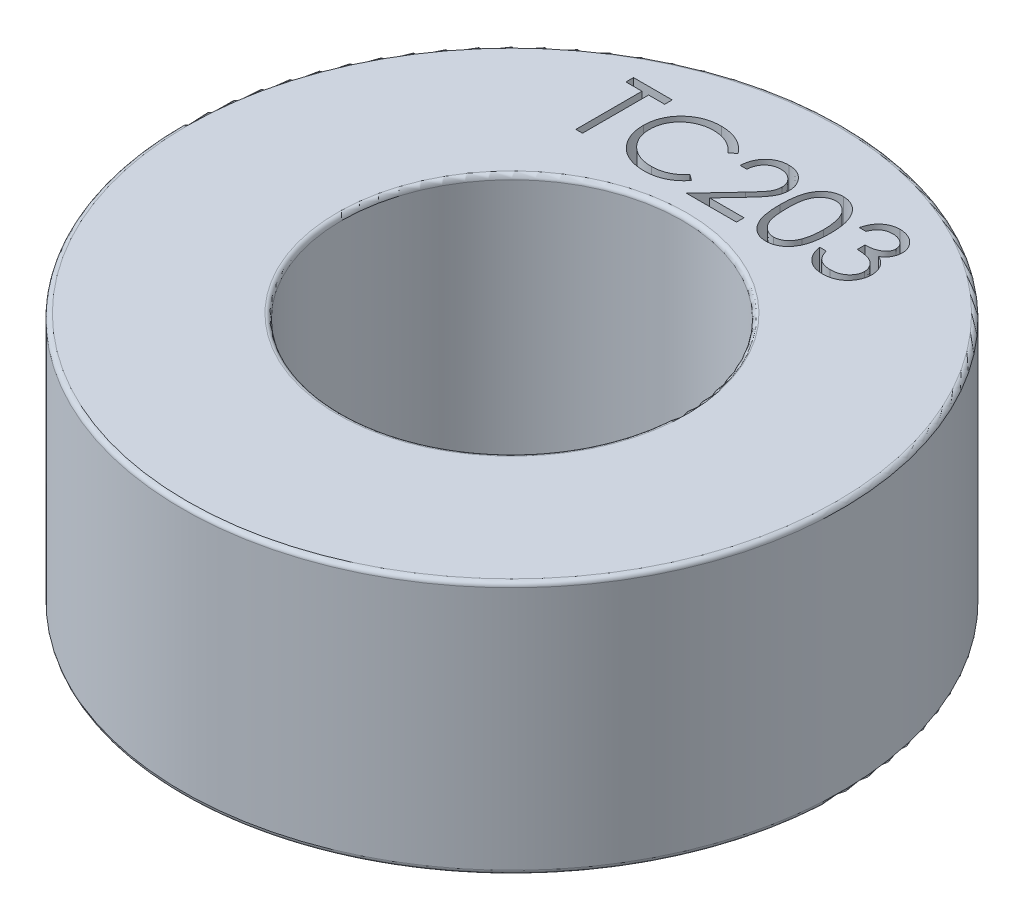
from build123d import *

# Parameters (mm, degrees)
CUT_EXTRUDE1_DEPTH = 1


with BuildPart() as part:
    # Toroidal Core TC229 → Revolve2 (revolve)
    with BuildSketch(Plane.XY, mode=Mode.PRIVATE) as revolve2_sk:
        with BuildLine():
            Line((5.646058459, 0), (10.503941541, 0))
            ThreePointArc((10.503941541, 0), (10.607220468, 0.042779532), (10.65, 0.146058459))
            Line((10.65, 0.146058459), (10.65, 8.053941541))
            ThreePointArc((10.65, 8.053941541), (10.607220468, 8.157220468), (10.503941541, 8.2))
            Line((10.503941541, 8.2), (5.646058459, 8.2))
            ThreePointArc((5.646058459, 8.2), (5.542779532, 8.157220468), (5.5, 8.053941541))
            Line((5.5, 8.053941541), (5.5, 0.146058459))
            ThreePointArc((5.5, 0.146058459), (5.542779532, 0.042779532), (5.646058459, 0))
        make_face()
    revolve(revolve2_sk.sketch.rotate(Axis((0, -8.107972275, 0), (0, 1, 0)), 90), axis=Axis((0, -8.107972275, 0), (0, 1, 0)))

    # Sketch1 → Cut-Extrude1 (cut)
    # profile 1 of 5: a face of its own
    with BuildSketch(Plane(origin=(0, 8.2, 0), x_dir=(1, 0, 0), z_dir=(0, 1, 0))):
        Polygon((-4.639181187, 8.322520552), (-4.639181187, 8.566751321), (-3.387498495, 8.566751321), (-3.387498495, 8.322520552), (-3.90648888, 8.322520552), (-3.90648888, 6.185501321), (-4.120190803, 6.185501321), (-4.120190803, 8.322520552), align=None)
    # profile 2 of 5: a face of its own
    with BuildSketch(Plane(origin=(0, 8.2, 0), x_dir=(1, 0, 0), z_dir=(0, 1, 0))):
        with BuildLine():
            Line((-0.823075418, 8.129807211), (-1.010064601, 7.986703244))
            add(Edge.make_bspline(
                [(-1.010064601, 7.986703244), (-1.023403607, 8.002600449), (-1.049901781, 8.034180529), (-1.092532417, 8.078525898), (-1.136960856, 8.120072085), (-1.183170115, 8.159017006), (-1.231991945, 8.19399877), (-1.282243666, 8.22684036), (-1.334765908, 8.256277874), (-1.407395213, 8.291971442), (-1.502405624, 8.329218379), (-1.622008899, 8.360448971), (-1.746861985, 8.380329806), (-1.832041066, 8.382483029), (-1.875366584, 8.383578244)],
                knots=[0, 0, 0, 0, 0.757959112, 1.505699292, 2.245454638, 2.979532153, 3.711538275, 4.438200793, 5.171680507, 5.909471876, 7.393775596, 8.890124382, 10.418191784, 12, 12, 12, 12], degree=3))
            add(Edge.make_bspline(
                [(-1.875366584, 8.383578244), (-1.899235757, 8.383303406), (-1.946752575, 8.382756279), (-2.017270555, 8.375538285), (-2.086471756, 8.365393337), (-2.154311164, 8.350340215), (-2.220702427, 8.331308844), (-2.286079579, 8.308567625), (-2.349496076, 8.280431564), (-2.411829199, 8.249333623), (-2.471550412, 8.214208522), (-2.528057507, 8.175895331), (-2.581144392, 8.134822785), (-2.630853062, 8.090836943), (-2.677234334, 8.044135895), (-2.71995213, 7.994221941), (-2.758858632, 7.941254658), (-2.794725037, 7.885932501), (-2.826846557, 7.82841661), (-2.853740993, 7.768494107), (-2.877556978, 7.707191137), (-2.896402355, 7.643815079), (-2.911318857, 7.578811876), (-2.921611071, 7.512007072), (-2.928746977, 7.44354023), (-2.929291383, 7.397133536), (-2.929565803, 7.373741255)],
                knots=[0, 0, 0, 0, 1.054917814, 2.100044995, 3.131103042, 4.146048494, 5.169673617, 6.183595914, 7.203665975, 8.234915748, 9.262203917, 10.264457458, 11.251630812, 12.227803204, 13.197192746, 14.159520551, 15.12972552, 16.100847026, 17.073214652, 18.039054194, 19.002613845, 19.979014051, 20.95965708, 21.949030935, 22.966165397, 24, 24, 24, 24], degree=3))
            add(Edge.make_bspline(
                [(-2.929565803, 7.373741255), (-2.928707315, 7.338545482), (-2.927021789, 7.26944325), (-2.912021047, 7.168226103), (-2.889225619, 7.071261144), (-2.855061092, 6.979154502), (-2.812934024, 6.890770422), (-2.759702465, 6.807604345), (-2.698050857, 6.728399504), (-2.627107011, 6.655027784), (-2.549270196, 6.588003268), (-2.465757778, 6.52898189), (-2.376777754, 6.479781943), (-2.283312582, 6.438840808), (-2.18464303, 6.407369713), (-2.08094653, 6.385214479), (-1.972448619, 6.37076221), (-1.898310509, 6.369378576), (-1.860579174, 6.368674398)],
                knots=[0, 0, 0, 0, 1.029171465, 2.020641659, 2.987623507, 3.938342917, 4.889210282, 5.84687017, 6.821220943, 7.821438502, 8.827599549, 9.822697543, 10.807740252, 11.797342354, 12.80366471, 13.83203677, 14.896651826, 16, 16, 16, 16], degree=3))
            add(Edge.make_bspline(
                [(-1.860579174, 6.368674398), (-1.819007523, 6.369823372), (-1.737184569, 6.372084826), (-1.617191323, 6.391243172), (-1.502322704, 6.422306863), (-1.392572533, 6.465780271), (-1.288250212, 6.522294333), (-1.189192484, 6.590804853), (-1.095315737, 6.671963522), (-1.038865632, 6.733932579), (-1.010064601, 6.765549398)],
                knots=[0, 0, 0, 0, 1.028121516, 2.023589091, 2.998037872, 3.967518031, 4.937445131, 5.927275754, 6.942489185, 8, 8, 8, 8], degree=3))
            Line((-1.010064601, 6.765549398), (-0.823075418, 6.623876472))
            add(Edge.make_bspline(
                [(-0.823075418, 6.623876472), (-0.838123632, 6.604460132), (-0.86814798, 6.565720456), (-0.916764952, 6.511107025), (-0.967980399, 6.459737315), (-1.022174731, 6.412025487), (-1.078724514, 6.367016824), (-1.138645141, 6.325990042), (-1.201148893, 6.288372494), (-1.266023994, 6.253928104), (-1.333201514, 6.223368335), (-1.40260096, 6.197206039), (-1.473923191, 6.174669284), (-1.547171467, 6.156128234), (-1.622497723, 6.1416563), (-1.699630135, 6.131981843), (-1.778735175, 6.125353862), (-1.832103356, 6.124749762), (-1.859148134, 6.124443629)],
                knots=[0, 0, 0, 0, 0.986787822, 1.968848986, 2.935600012, 3.899624008, 4.868462664, 5.837806735, 6.815139263, 7.798259679, 8.787526145, 9.778297419, 10.776456485, 11.791383307, 12.812564526, 13.85620153, 14.913611965, 16, 16, 16, 16], degree=3))
            add(Edge.make_bspline(
                [(-1.859148134, 6.124443629), (-1.884759272, 6.124621878), (-1.935402126, 6.124974342), (-2.010172526, 6.130684013), (-2.082963652, 6.138473923), (-2.15356746, 6.15020337), (-2.222369239, 6.164044787), (-2.28874528, 6.182598981), (-2.353348735, 6.203383325), (-2.415920053, 6.227811539), (-2.476512456, 6.255377013), (-2.534930513, 6.286531627), (-2.591147357, 6.321013396), (-2.645715688, 6.358062251), (-2.697829401, 6.398868237), (-2.747940103, 6.442864644), (-2.796328788, 6.489903183), (-2.826266329, 6.523822289), (-2.841318357, 6.540876171)],
                knots=[0, 0, 0, 0, 1.114604814, 2.203992996, 3.262667896, 4.300477797, 5.318619304, 6.316056647, 7.298880507, 8.271930387, 9.238335007, 10.195173496, 11.151986948, 12.108099108, 13.064862484, 14.031167946, 15.010108607, 16, 16, 16, 16], degree=3))
            add(Edge.make_bspline(
                [(-2.841318357, 6.540876171), (-2.86542725, 6.57049973), (-2.913353973, 6.629389206), (-2.974671625, 6.724833776), (-3.027159515, 6.824484468), (-3.069597419, 6.928864812), (-3.102773492, 7.037740588), (-3.12575677, 7.151166679), (-3.140691701, 7.269037154), (-3.142399594, 7.349208255), (-3.143267726, 7.389959705)],
                knots=[0, 0, 0, 0, 0.994628077, 1.977248131, 2.950237994, 3.925870899, 4.908910175, 5.911660606, 6.938484602, 8, 8, 8, 8], degree=3))
            add(Edge.make_bspline(
                [(-3.143267726, 7.389959705), (-3.142209639, 7.432791897), (-3.140127918, 7.517061562), (-3.122441493, 7.64073277), (-3.093989777, 7.759217918), (-3.053578679, 7.872295823), (-3.002344146, 7.980561245), (-2.939052824, 8.083187136), (-2.864440001, 8.180829816), (-2.779090852, 8.27200771), (-2.685495933, 8.355378233), (-2.585266526, 8.428724954), (-2.478598808, 8.489764907), (-2.366667913, 8.540789082), (-2.24863569, 8.580007904), (-2.124753969, 8.607462483), (-1.995255529, 8.624551092), (-1.9069027, 8.626711368), (-1.862010214, 8.627809014)],
                knots=[0, 0, 0, 0, 1.032925535, 2.032216505, 3.007276963, 3.968222605, 4.92396291, 5.891752235, 6.871517503, 7.883894988, 8.900124299, 9.891468569, 10.874487609, 11.85992873, 12.854644235, 13.869047385, 14.917252991, 16, 16, 16, 16], degree=3))
            add(Edge.make_bspline(
                [(-1.862010214, 8.627809014), (-1.83465001, 8.627480988), (-1.780493244, 8.626831693), (-1.700379385, 8.620500193), (-1.622381659, 8.6099454), (-1.546446331, 8.595578931), (-1.472203979, 8.577748592), (-1.40022203, 8.554520997), (-1.330078102, 8.527962214), (-1.26221458, 8.4973744), (-1.19695707, 8.463038992), (-1.134325896, 8.425336577), (-1.074818555, 8.384313895), (-1.01801632, 8.340319842), (-0.964869398, 8.292423679), (-0.913868821, 8.241942815), (-0.866746552, 8.187423195), (-0.83765911, 8.149047695), (-0.823075418, 8.129807211)],
                knots=[0, 0, 0, 0, 1.096760587, 2.17092713, 3.219439832, 4.250915756, 5.268269357, 6.278326846, 7.281116186, 8.274029601, 9.260640565, 10.235837813, 11.203064059, 12.156899882, 13.114053108, 14.069676657, 15.032185724, 16, 16, 16, 16], degree=3))
        make_face()
    # profile 3 of 5: a face of its own
    with BuildSketch(Plane(origin=(0, 8.2, 0), x_dir=(1, 0, 0), z_dir=(0, 1, 0))):
        with BuildLine():
            Line((-0.243027341, 7.834059014), (-0.456729264, 7.834059014))
            add(Edge.make_bspline(
                [(-0.456729264, 7.834059014), (-0.455336469, 7.8624101), (-0.452601056, 7.918090879), (-0.439791095, 7.999273751), (-0.421461677, 8.076871748), (-0.395545884, 8.150261814), (-0.36336072, 8.22009286), (-0.324764041, 8.286087513), (-0.279048225, 8.347994018), (-0.227200429, 8.405238481), (-0.170888194, 8.457753597), (-0.11012826, 8.503102967), (-0.046280126, 8.541419097), (0.020462501, 8.573451156), (0.090852635, 8.597494873), (0.164251507, 8.615334953), (0.240981598, 8.626068502), (0.293260256, 8.627222242), (0.31984826, 8.627809014)],
                knots=[0, 0, 0, 0, 1.10065271, 2.161652631, 3.183658789, 4.190468796, 5.17591951, 6.163126047, 7.15150782, 8.156236427, 9.156009102, 10.134482811, 11.092018607, 12.041330605, 13.001268258, 13.972401359, 14.968799086, 16, 16, 16, 16], degree=3))
            add(Edge.make_bspline(
                [(0.31984826, 8.627809014), (0.345959057, 8.627197742), (0.39726584, 8.625996616), (0.472147317, 8.615681702), (0.543433298, 8.599526219), (0.610984439, 8.576859837), (0.67426178, 8.546390432), (0.733740672, 8.509788893), (0.790129224, 8.467457186), (0.840888482, 8.417618431), (0.887498443, 8.36441288), (0.927709085, 8.307611288), (0.962144112, 8.248944578), (0.990846801, 8.187965391), (1.011976067, 8.124099566), (1.02801767, 8.058276915), (1.037085071, 7.989816107), (1.038476689, 7.943479325), (1.039184197, 7.919921394)],
                knots=[0, 0, 0, 0, 1.111607364, 2.184268762, 3.212621178, 4.221274766, 5.211760367, 6.196651075, 7.1921475, 8.207485113, 9.220403448, 10.201281604, 11.166441695, 12.114753415, 13.065576456, 14.026450734, 14.996634279, 16, 16, 16, 16], degree=3))
            add(Edge.make_bspline(
                [(1.039184197, 7.919921394), (1.038032174, 7.886755456), (1.035748343, 7.821005596), (1.016212312, 7.72438477), (0.985700668, 7.630772105), (0.94896318, 7.55543119), (0.911902464, 7.494720545), (0.878505428, 7.444735587), (0.839408833, 7.390915617), (0.794043641, 7.333440857), (0.743348276, 7.271861116), (0.686863554, 7.206213595), (0.624186685, 7.137176551), (0.580195812, 7.09002399), (0.557400844, 7.065590714)],
                knots=[0, 0, 0, 0, 1.184426356, 2.348067706, 3.509069118, 4.696110526, 5.333549288, 6.050745305, 6.844228056, 7.710549037, 8.667450064, 9.695053472, 10.805634456, 12, 12, 12, 12], degree=3))
            Line((0.557400844, 7.065590714), (-0.038388669, 6.429732091))
            Line((-0.038388669, 6.429732091), (1.069713043, 6.429732091))
            Line((1.069713043, 6.429732091), (1.069713043, 6.185501321))
            Line((1.069713043, 6.185501321), (-0.548315803, 6.185501321))
            Line((-0.548315803, 6.185501321), (0.375181793, 7.171010636))
            add(Edge.make_bspline(
                [(0.375181793, 7.171010636), (0.397666159, 7.194481806), (0.440854025, 7.239565118), (0.501938242, 7.305384882), (0.556801554, 7.366446623), (0.605799101, 7.422634971), (0.647867968, 7.474771806), (0.685200683, 7.52116856), (0.715112987, 7.563863998), (0.747576497, 7.613353594), (0.77901851, 7.673777689), (0.806037095, 7.74761936), (0.82251184, 7.823633794), (0.824488166, 7.875002144), (0.825482274, 7.900840865)],
                knots=[0, 0, 0, 0, 1.329631726, 2.553950428, 3.673215718, 4.687767853, 5.603093632, 6.413772471, 7.123043292, 7.734684054, 8.834405432, 9.900288307, 10.943827018, 12, 12, 12, 12], degree=3))
            add(Edge.make_bspline(
                [(0.825482274, 7.900840865), (0.825049742, 7.917088745), (0.824197305, 7.949110196), (0.816674122, 7.996058757), (0.80530501, 8.041346604), (0.789013682, 8.085113039), (0.767509811, 8.126918027), (0.741334172, 8.166812456), (0.711133075, 8.205381198), (0.676195872, 8.241544424), (0.637815892, 8.27466503), (0.597270519, 8.30400481), (0.55437393, 8.328524276), (0.50930699, 8.348624406), (0.46219534, 8.364391942), (0.412947861, 8.375317511), (0.361700629, 8.382177201), (0.326707483, 8.383105325), (0.308876956, 8.383578244)],
                knots=[0, 0, 0, 0, 0.991446411, 1.95395049, 2.89581595, 3.838931463, 4.798493298, 5.75982156, 6.748411868, 7.785213223, 8.824556874, 9.840280684, 10.836137867, 11.835679398, 12.848801643, 13.863922112, 14.911575587, 16, 16, 16, 16], degree=3))
            add(Edge.make_bspline(
                [(0.308876956, 8.383578244), (0.290255014, 8.383091767), (0.253684596, 8.382136406), (0.199991468, 8.375453486), (0.148770251, 8.363924263), (0.0998921, 8.348155847), (0.05327431, 8.328113513), (0.009143594, 8.303150022), (-0.032400979, 8.27336161), (-0.071437506, 8.239588303), (-0.107403892, 8.201986596), (-0.139004356, 8.160069817), (-0.16661598, 8.114603308), (-0.190706904, 8.065709747), (-0.210271044, 8.012945479), (-0.225220633, 7.956497809), (-0.237049899, 7.896611833), (-0.241001767, 7.855256266), (-0.243027341, 7.834059014)],
                knots=[0, 0, 0, 0, 1.031018746, 2.02475058, 2.990194455, 3.934040569, 4.864654155, 5.795059489, 6.735614925, 7.690564532, 8.649604399, 9.611025574, 10.590972636, 11.591080095, 12.624614302, 13.701020113, 14.821632451, 16, 16, 16, 16], degree=3))
        make_face()
    # profile 4 of 5: a face of its own
    with BuildSketch(Plane(origin=(0, 8.2, 0), x_dir=(1, 0, 0), z_dir=(0, 1, 0))):
        with BuildLine():
            add(Edge.make_bspline(
                [(1.283414967, 7.375172295), (1.283638136, 7.413338553), (1.284071646, 7.487477061), (1.288894304, 7.595507326), (1.296905742, 7.696853523), (1.307884919, 7.791520501), (1.321245759, 7.879532702), (1.339081653, 7.960654921), (1.359365006, 8.035262617), (1.382873009, 8.103599082), (1.40939863, 8.166584984), (1.438269082, 8.225384987), (1.47063013, 8.279910123), (1.50463228, 8.331030655), (1.541651921, 8.377909776), (1.580635563, 8.421209516), (1.623104732, 8.459929152), (1.667615743, 8.495203154), (1.714571587, 8.526125027), (1.76263383, 8.553361587), (1.812133286, 8.57662971), (1.8632051, 8.594924811), (1.915390233, 8.610036119), (1.968871112, 8.620370028), (2.02373604, 8.626872139), (2.060768856, 8.627493759), (2.079550033, 8.627809014)],
                knots=[0, 0, 0, 0, 1.646270934, 3.197905019, 4.663502075, 6.030701355, 7.308322542, 8.50163776, 9.611534131, 10.641858119, 11.616356847, 12.558055219, 13.465016945, 14.349605745, 15.204443733, 16.039544428, 16.859896111, 17.680448484, 18.487036065, 19.28249412, 20.06191084, 20.843045899, 21.620316918, 22.403196591, 23.190181807, 24, 24, 24, 24], degree=3))
            add(Edge.make_bspline(
                [(2.079550033, 8.627809014), (2.098488099, 8.627477125), (2.136149955, 8.626817103), (2.191830639, 8.620473492), (2.246224976, 8.609947603), (2.299101067, 8.595033512), (2.350893245, 8.576530739), (2.401196408, 8.553339325), (2.450323012, 8.526343524), (2.497492368, 8.494622636), (2.543222312, 8.459256123), (2.586389587, 8.419276522), (2.626998122, 8.375087517), (2.665557571, 8.327161891), (2.700973968, 8.274580432), (2.734701607, 8.218257671), (2.764890439, 8.157208637), (2.79396528, 8.092451925), (2.819061605, 8.022195758), (2.841694533, 7.946836162), (2.859981831, 7.865483009), (2.875214532, 7.778563135), (2.887015256, 7.68575733), (2.895609964, 7.587264533), (2.900150045, 7.483019946), (2.901005051, 7.411747195), (2.901443813, 7.375172295)],
                knots=[0, 0, 0, 0, 0.810914788, 1.612654377, 2.396697861, 3.181598691, 3.963628158, 4.749916497, 5.551656086, 6.361998678, 7.18212741, 8.025565596, 8.878627764, 9.750805457, 10.657531673, 11.591944965, 12.560506719, 13.57287815, 14.630710178, 15.753379473, 16.941251878, 18.199788006, 19.531962791, 20.947069417, 22.433333509, 24, 24, 24, 24], degree=3))
            add(Edge.make_bspline(
                [(2.901443813, 7.375172295), (2.901000503, 7.338756922), (2.900136731, 7.267803052), (2.895660861, 7.164027514), (2.886844363, 7.066057417), (2.875815782, 6.973657798), (2.860541109, 6.88721324), (2.841759737, 6.806424606), (2.820906571, 6.730943015), (2.795165398, 6.66138683), (2.766991326, 6.596785747), (2.736337701, 6.53646042), (2.70349698, 6.479877638), (2.667717852, 6.427490311), (2.629581512, 6.378927331), (2.588271731, 6.335045913), (2.544952993, 6.294788724), (2.499088475, 6.258966813), (2.451183473, 6.227612687), (2.402225601, 6.199572549), (2.351346192, 6.176962448), (2.299698272, 6.157548429), (2.24654308, 6.142716336), (2.191946875, 6.132460731), (2.136187365, 6.125268098), (2.098494514, 6.124719404), (2.079550033, 6.124443629)],
                knots=[0, 0, 0, 0, 1.561518951, 3.042555995, 4.452378317, 5.7783523, 7.031515105, 8.214008947, 9.334062868, 10.386615937, 11.391082383, 12.354592575, 13.286541444, 14.194233754, 15.072674879, 15.931287219, 16.775624067, 17.606195743, 18.42308326, 19.229000347, 20.022332153, 20.807536673, 21.593273796, 22.3848459, 23.188221202, 24, 24, 24, 24], degree=3))
            add(Edge.make_bspline(
                [(2.079550033, 6.124443629), (2.060769377, 6.124760917), (2.023737588, 6.125386548), (1.968865135, 6.131859283), (1.915605115, 6.142265688), (1.863694713, 6.156836627), (1.812867602, 6.174672079), (1.763816378, 6.197908781), (1.71599565, 6.224669996), (1.669533003, 6.255146881), (1.625301514, 6.290063955), (1.583052285, 6.328683944), (1.543846691, 6.371970586), (1.507356351, 6.419240387), (1.472675766, 6.470058468), (1.440774246, 6.525118665), (1.411266576, 6.584202655), (1.384294844, 6.647692163), (1.3603812, 6.71651364), (1.33925767, 6.791454421), (1.322579287, 6.873175952), (1.308303384, 6.961021875), (1.296788759, 7.055369674), (1.288927691, 7.156270569), (1.284069047, 7.263661685), (1.283636972, 7.337323799), (1.283414967, 7.375172295)],
                knots=[0, 0, 0, 0, 0.810891512, 1.598919785, 2.382837074, 3.152667961, 3.926044502, 4.706494248, 5.493654104, 6.291793342, 7.103789334, 7.925228297, 8.761435821, 9.622817696, 10.50288917, 11.416980706, 12.369136599, 13.353924996, 14.394355917, 15.514179734, 16.714354668, 17.994756427, 19.357759367, 20.818452758, 22.365282078, 24, 24, 24, 24], degree=3))
        make_face()
        with BuildLine():
            add(Edge.make_bspline(
                [(1.49711689, 7.376126321), (1.497198156, 7.34432051), (1.497355879, 7.282591676), (1.501476258, 7.192891172), (1.507089363, 7.10922743), (1.514329245, 7.031494221), (1.525080894, 6.959954659), (1.537127834, 6.894116713), (1.55178823, 6.834328808), (1.569133948, 6.780180672), (1.588890905, 6.730753359), (1.610462216, 6.68476039), (1.633635672, 6.641658447), (1.659570308, 6.601834689), (1.687815378, 6.565159245), (1.717732899, 6.530982979), (1.750439425, 6.500505032), (1.795685721, 6.463951583), (1.85541868, 6.426178744), (1.930680096, 6.393286136), (2.008015239, 6.372615215), (2.060505643, 6.369986481), (2.086705231, 6.368674398)],
                knots=[0, 0, 0, 0, 1.459021318, 2.831673884, 4.118529203, 5.306027144, 6.411944654, 7.436330062, 8.375795394, 9.233974572, 10.042671642, 10.816086306, 11.563610507, 12.285937304, 12.993564865, 13.685989202, 14.367179055, 15.041617293, 16.353048772, 17.594441528, 18.799311195, 20, 20, 20, 20], degree=3))
            add(Edge.make_bspline(
                [(2.086705231, 6.368674398), (2.11307429, 6.36976146), (2.165757965, 6.371933339), (2.242729351, 6.39288748), (2.317453159, 6.424503363), (2.376012819, 6.461887291), (2.420564335, 6.497489243), (2.452484644, 6.527843138), (2.481782217, 6.561830969), (2.509569414, 6.59850174), (2.535054964, 6.638556055), (2.558230063, 6.681801307), (2.57937784, 6.728357587), (2.591426316, 6.76085807), (2.597586391, 6.777474729)],
                knots=[0, 0, 0, 0, 1.353760809, 2.704726607, 4.075137775, 5.516104923, 6.260822281, 7.007110065, 7.778089737, 8.566572457, 9.372053459, 10.217411131, 11.088608312, 12, 12, 12, 12], degree=3))
            add(Edge.make_bspline(
                [(2.597586391, 6.777474729), (2.604765361, 6.798722105), (2.61934175, 6.841863391), (2.638127618, 6.908785804), (2.652922256, 6.979000542), (2.666232332, 7.052087988), (2.675317179, 7.128587141), (2.68262953, 7.208261306), (2.686936658, 7.291170554), (2.687470569, 7.347500718), (2.68774189, 7.376126321)],
                knots=[0, 0, 0, 0, 0.884706709, 1.796334032, 2.740027952, 3.714592787, 4.726048262, 5.777819803, 6.87074269, 8, 8, 8, 8], degree=3))
            add(Edge.make_bspline(
                [(2.68774189, 7.376126321), (2.687367564, 7.404747295), (2.686635304, 7.460736037), (2.683836323, 7.542731442), (2.676608499, 7.620610401), (2.668580884, 7.694708419), (2.65674456, 7.764615322), (2.643982552, 7.830916333), (2.626836728, 7.892790069), (2.608521666, 7.951205249), (2.587559594, 8.005498194), (2.564484782, 8.055922038), (2.539841049, 8.102720217), (2.513074275, 8.145764333), (2.484502212, 8.185247188), (2.453370737, 8.220377153), (2.420914726, 8.252243019), (2.375455176, 8.28861666), (2.315941418, 8.325704081), (2.241887505, 8.359834714), (2.164823013, 8.379434642), (2.112725716, 8.382198039), (2.086705231, 8.383578244)],
                knots=[0, 0, 0, 0, 1.31362396, 2.569729283, 3.763502607, 4.902122613, 5.988968491, 7.01645872, 7.998833611, 8.933434873, 9.825090667, 10.667526885, 11.477055099, 12.250526234, 12.991942729, 13.710640831, 14.402115721, 15.076753259, 16.378508321, 17.609869233, 18.806226677, 20, 20, 20, 20], degree=3))
            add(Edge.make_bspline(
                [(2.086705231, 8.383578244), (2.060368203, 8.382196135), (2.007646168, 8.379429399), (1.929780684, 8.359907739), (1.855142545, 8.32588106), (1.795786164, 8.288493821), (1.750294909, 8.252885077), (1.718261863, 8.222006079), (1.688226699, 8.188228895), (1.660558139, 8.151216164), (1.634643823, 8.111438833), (1.610844241, 8.068583977), (1.589401201, 8.022434424), (1.569613329, 7.973029314), (1.5522147, 7.91888585), (1.537863271, 7.859171588), (1.524605115, 7.793543051), (1.515219406, 7.721616029), (1.506875672, 7.643863349), (1.50151354, 7.559990745), (1.497342096, 7.470139801), (1.497193462, 7.408091802), (1.49711689, 7.376126321)],
                knots=[0, 0, 0, 0, 1.207732386, 2.417664972, 3.655092373, 4.956220595, 5.625982001, 6.301752483, 6.994047911, 7.697131622, 8.419323945, 9.170223765, 9.943494443, 10.752040957, 11.610060368, 12.549350801, 13.567764191, 14.679664412, 15.874934091, 17.154273443, 18.533957287, 20, 20, 20, 20], degree=3))
        make_face(mode=Mode.SUBTRACT)
    # profile 5 of 5: a face of its own
    with BuildSketch(Plane(origin=(0, 8.2, 0), x_dir=(1, 0, 0), z_dir=(0, 1, 0))):
        with BuildLine():
            Line((3.420434197, 8.017232091), (3.206732274, 8.017232091))
            add(Edge.make_bspline(
                [(3.206732274, 8.017232091), (3.212521808, 8.041202763), (3.223839872, 8.088063466), (3.247446614, 8.155015549), (3.273163608, 8.218372802), (3.304044409, 8.276948881), (3.337728044, 8.331920991), (3.376319753, 8.382042306), (3.418039064, 8.428587556), (3.464184252, 8.469894241), (3.512577145, 8.507298732), (3.563899628, 8.539190512), (3.617119132, 8.566625337), (3.672604389, 8.589226959), (3.730520588, 8.606253253), (3.790344135, 8.618606365), (3.852231802, 8.626628534), (3.894242216, 8.627411464), (3.915573921, 8.627809014)],
                knots=[0, 0, 0, 0, 1.162005537, 2.271625781, 3.343758855, 4.383309926, 5.390229558, 6.379919256, 7.361854164, 8.333198761, 9.295911338, 10.242430842, 11.177959212, 12.116337295, 13.062827104, 14.020064771, 14.994644689, 16, 16, 16, 16], degree=3))
            add(Edge.make_bspline(
                [(3.915573921, 8.627809014), (3.946654501, 8.626870645), (4.008137703, 8.625014375), (4.09846399, 8.60806366), (4.185567951, 8.58124049), (4.268496171, 8.5441789), (4.345525141, 8.498467532), (4.414061725, 8.444062952), (4.473176944, 8.382014856), (4.522771154, 8.313480736), (4.561602538, 8.240236541), (4.590236302, 8.164852863), (4.607668196, 8.087508522), (4.609927361, 8.035286159), (4.611059197, 8.009122866)],
                knots=[0, 0, 0, 0, 1.083050992, 2.142477498, 3.193116406, 4.255571735, 5.30263384, 6.308962982, 7.297363603, 8.282367274, 9.249857812, 10.179914175, 11.08814088, 12, 12, 12, 12], degree=3))
            add(Edge.make_bspline(
                [(4.611059197, 8.009122866), (4.61026754, 7.983945029), (4.608718389, 7.934675909), (4.595564564, 7.862747533), (4.573428285, 7.794955658), (4.542764751, 7.731014904), (4.50307166, 7.671330682), (4.454988986, 7.61576871), (4.398177354, 7.564082551), (4.355125076, 7.534473766), (4.332960489, 7.519230288)],
                knots=[0, 0, 0, 0, 1.024540389, 2.004866551, 2.965041327, 3.920577974, 4.882998113, 5.874504559, 6.905732034, 8, 8, 8, 8], degree=3))
            add(Edge.make_bspline(
                [(4.332960489, 7.519230288), (4.35829138, 7.50699871), (4.408479199, 7.482764418), (4.47688947, 7.435237554), (4.538991025, 7.380362432), (4.573623734, 7.337538949), (4.591024642, 7.316022656)],
                knots=[0, 0, 0, 0, 1.015518401, 2.012035669, 3.001164323, 4, 4, 4, 4], degree=3))
            add(Edge.make_bspline(
                [(4.591024642, 7.316022656), (4.60248277, 7.30033515), (4.62521139, 7.269217031), (4.65326628, 7.219185999), (4.678717838, 7.168600432), (4.698550398, 7.116104479), (4.71390869, 7.062306589), (4.724886954, 7.007114388), (4.73170695, 6.950482804), (4.732683638, 6.912170206), (4.733174582, 6.892911928)],
                knots=[0, 0, 0, 0, 1.025084078, 2.033381695, 3.024893161, 4.013698104, 4.991890475, 5.976764909, 6.982997093, 8, 8, 8, 8], degree=3))
            add(Edge.make_bspline(
                [(4.733174582, 6.892911928), (4.731953672, 6.859567814), (4.729517597, 6.793036505), (4.707743397, 6.694742096), (4.673988674, 6.598658317), (4.626052794, 6.506759185), (4.567632221, 6.42077539), (4.498128756, 6.343843115), (4.418332111, 6.277713351), (4.329337553, 6.222461392), (4.232919292, 6.17829402), (4.129793756, 6.147638867), (4.021446844, 6.127673106), (3.947146879, 6.125532112), (3.909372749, 6.124443629)],
                knots=[0, 0, 0, 0, 0.955779014, 1.907060117, 2.875433937, 3.871313158, 4.872415639, 5.851225146, 6.836215519, 7.83643374, 8.849228613, 9.86973379, 10.916971861, 12, 12, 12, 12], degree=3))
            add(Edge.make_bspline(
                [(3.909372749, 6.124443629), (3.883914261, 6.125034324), (3.833820445, 6.126196615), (3.760176208, 6.134142235), (3.689880552, 6.148654256), (3.622838433, 6.168182755), (3.558990292, 6.192942137), (3.498530963, 6.223775037), (3.441088482, 6.260045898), (3.38720491, 6.302182857), (3.33688667, 6.349318911), (3.291470977, 6.402290845), (3.250200654, 6.460119436), (3.214180752, 6.523476372), (3.181770611, 6.591542877), (3.155113567, 6.665190517), (3.131651064, 6.743760896), (3.120742582, 6.798514501), (3.115145736, 6.826607091)],
                knots=[0, 0, 0, 0, 1.048658725, 2.063410685, 3.046034179, 4.001477787, 4.936774919, 5.862367409, 6.792675028, 7.730719943, 8.675894397, 9.627829632, 10.600096036, 11.597688215, 12.626045268, 13.701542398, 14.82072376, 16, 16, 16, 16], degree=3))
            Line((3.115145736, 6.826607091), (3.328847659, 6.826607091))
            add(Edge.make_bspline(
                [(3.328847659, 6.826607091), (3.33441522, 6.808272137), (3.345244609, 6.772609059), (3.363678408, 6.721282709), (3.384679858, 6.674230533), (3.407209584, 6.631107373), (3.430871348, 6.591488542), (3.457347396, 6.556421664), (3.48467676, 6.524366499), (3.505277535, 6.506306683), (3.515359828, 6.497467968)],
                knots=[0, 0, 0, 0, 1.198163088, 2.33053128, 3.407730985, 4.417276592, 5.372219308, 6.28897303, 7.162600585, 8, 8, 8, 8], degree=3))
            add(Edge.make_bspline(
                [(3.515359828, 6.497467968), (3.528692499, 6.487188905), (3.555316686, 6.466662509), (3.598701857, 6.440467651), (3.644329932, 6.417770239), (3.693189558, 6.400432224), (3.744226393, 6.385751709), (3.798265368, 6.376144713), (3.854829729, 6.369553296), (3.893452082, 6.368971637), (3.913188855, 6.368674398)],
                knots=[0, 0, 0, 0, 0.946170439, 1.889420265, 2.845303464, 3.807233317, 4.801018734, 5.828864929, 6.890507805, 8, 8, 8, 8], degree=3))
            add(Edge.make_bspline(
                [(3.913188855, 6.368674398), (3.935472934, 6.369093434), (3.979047528, 6.369912822), (4.042630209, 6.377448258), (4.103119026, 6.3884227), (4.159842392, 6.405372426), (4.213543326, 6.426314398), (4.263469056, 6.452609117), (4.310274978, 6.483459722), (4.353361591, 6.518524757), (4.392104874, 6.556911524), (4.42621765, 6.597061488), (4.455217643, 6.638805365), (4.478610756, 6.682374158), (4.497082827, 6.727587448), (4.509658004, 6.774572116), (4.518401624, 6.822943648), (4.519113694, 6.855824608), (4.519472659, 6.87240036)],
                knots=[0, 0, 0, 0, 1.217147791, 2.380027433, 3.494444702, 4.572153297, 5.609568379, 6.639424714, 7.649109417, 8.668170816, 9.669597737, 10.625200337, 11.543417969, 12.441394052, 13.322311151, 14.205496177, 15.095365482, 16, 16, 16, 16], degree=3))
            add(Edge.make_bspline(
                [(4.519472659, 6.87240036), (4.518431507, 6.894587717), (4.516354385, 6.938852031), (4.500496226, 7.003974166), (4.474412106, 7.066719023), (4.43789563, 7.126016088), (4.393444, 7.180972549), (4.34148859, 7.230006897), (4.281597956, 7.270467798), (4.22647551, 7.298422759), (4.177649573, 7.317497984), (4.135865177, 7.330203629), (4.089086131, 7.340962563), (4.037878133, 7.350972162), (3.981855338, 7.35949115), (3.921078736, 7.366595314), (3.855536012, 7.372279726), (3.810162201, 7.374818203), (3.786780351, 7.376126321)],
                knots=[0, 0, 0, 0, 1.07054697, 2.135767047, 3.216561865, 4.33974944, 5.486079747, 6.621378074, 7.775625952, 8.963672916, 9.598146892, 10.304877434, 11.070270905, 11.915000392, 12.823868403, 13.805723172, 14.86925407, 16, 16, 16, 16], degree=3))
            Line((3.786780351, 7.376126321), (3.786780351, 7.620357091))
            add(Edge.make_bspline(
                [(3.786780351, 7.620357091), (3.816240609, 7.62085702), (3.873946016, 7.621836258), (3.958238391, 7.633679922), (4.038842555, 7.650063349), (4.113972178, 7.675158453), (4.182449249, 7.704305155), (4.241857764, 7.738222462), (4.291365412, 7.775924282), (4.330731606, 7.81799254), (4.360347027, 7.863110456), (4.382000616, 7.910134468), (4.394791552, 7.959476731), (4.396499022, 7.993150782), (4.397357274, 8.010076892)],
                knots=[0, 0, 0, 0, 1.321986639, 2.589447074, 3.816329219, 5.01088745, 6.139805852, 7.153945165, 8.075214402, 8.924034688, 9.728124013, 10.488707548, 11.240355623, 12, 12, 12, 12], degree=3))
            add(Edge.make_bspline(
                [(4.397357274, 8.010076892), (4.397075327, 8.022512287), (4.396514406, 8.047251914), (4.389440543, 8.083395934), (4.378810616, 8.118434971), (4.364196728, 8.152220017), (4.344636325, 8.184516756), (4.321227967, 8.215600539), (4.293355027, 8.245293895), (4.261415357, 8.272971041), (4.227117325, 8.299347969), (4.189527746, 8.321740997), (4.149780006, 8.340889691), (4.1078301, 8.356680441), (4.063541891, 8.368558993), (4.017123465, 8.377087842), (3.968486309, 8.382420247), (3.935304113, 8.383187972), (3.918436, 8.383578244)],
                knots=[0, 0, 0, 0, 0.884392785, 1.759457502, 2.611959086, 3.489218968, 4.37281399, 5.2945488, 6.255912374, 7.266815255, 8.301784654, 9.332968512, 10.37626691, 11.440494194, 12.520033166, 13.637162961, 14.798855837, 16, 16, 16, 16], degree=3))
            add(Edge.make_bspline(
                [(3.918436, 8.383578244), (3.891322633, 8.382631621), (3.838363921, 8.380782646), (3.762017701, 8.364588096), (3.691043297, 8.338749436), (3.636792526, 8.307906792), (3.596731346, 8.277460515), (3.568104, 8.250870534), (3.539991296, 8.221320702), (3.514242719, 8.186990986), (3.488202746, 8.150206259), (3.464496, 8.109096576), (3.441459316, 8.064734301), (3.427578296, 8.033372806), (3.420434197, 8.017232091)],
                knots=[0, 0, 0, 0, 1.472543308, 2.876219568, 4.221790263, 5.565193594, 6.249813518, 6.953379497, 7.687249741, 8.463570142, 9.283606569, 10.136032583, 11.040678096, 12, 12, 12, 12], degree=3))
        make_face()
    extrude(amount=-CUT_EXTRUDE1_DEPTH, mode=Mode.SUBTRACT)


solid = part.part
